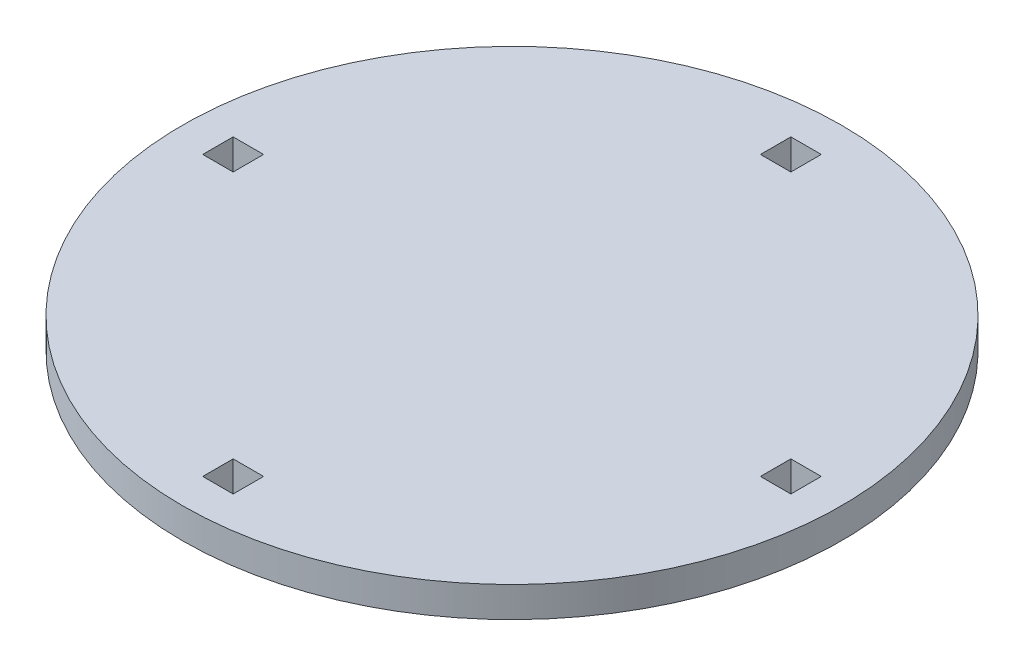
from build123d import *

# Parameters (mm, degrees)
SKETCH1_R           = 32.5
BOSS_EXTRUDE1_DEPTH = 3
SKETCH3_W           = 3
SKETCH3_H           = 3
CUT_EXTRUDE4_DEPTH  = 10


with BuildPart() as part:
    # Sketch1 → Boss-Extrude1 (new body)
    with BuildSketch(Plane(origin=(0, 0, 0), x_dir=(1, 0, 0), z_dir=(0, 1, 0))):
        with Locations(Location((0, 0, 0), (0, 0, 270))):
            Circle(SKETCH1_R)
    extrude(amount=BOSS_EXTRUDE1_DEPTH)

    # Sketch3 → Cut-Extrude4 (cut)
    with BuildSketch(Plane(origin=(0, 0, 0), x_dir=(1, 0, 0), z_dir=(0, 1, 0))):
        with Locations((27.5, 0)):
            Rectangle(SKETCH3_W, SKETCH3_H)
        with Locations((0, 27.5)):
            Rectangle(SKETCH3_W, SKETCH3_H)
        with Locations((0, -27.5)):
            Rectangle(SKETCH3_W, SKETCH3_H)
        with Locations((-27.5, 0)):
            Rectangle(SKETCH3_W, SKETCH3_H)
    extrude(amount=CUT_EXTRUDE4_DEPTH, mode=Mode.SUBTRACT)


solid = part.part
